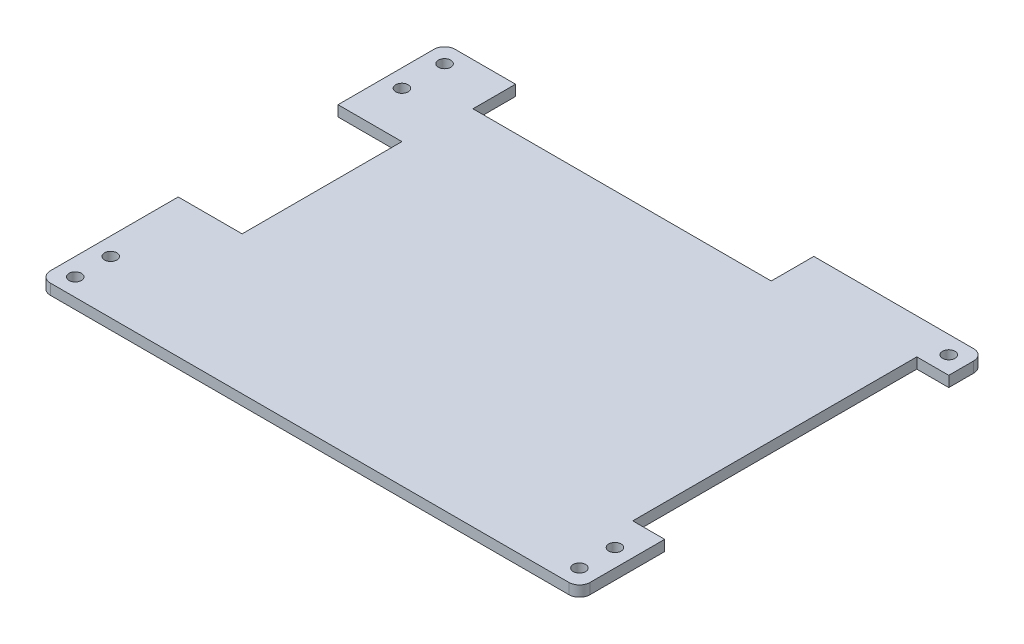
from build123d import *

# Parameters (mm, degrees)
SKETCH_1_R      = 1.75
EXTRUDE_1_DEPTH = 3


with BuildPart() as part:
    # 草图1 → 凸台-拉伸1 (new body)
    with BuildSketch(Plane(origin=(0, 0, 0), x_dir=(1, 0, 0), z_dir=(0, 1, 0))):
        with BuildLine():
            Line((-56, 57), (-56, 45))
            Line((-56, 45), (28, 45))
            Line((28, 45), (28, 57))
            Line((28, 57), (73, 57))
            ThreePointArc((73, 57), (75.121320344, 56.121320344), (76, 54))
            Line((76, 54), (76, 47))
            Line((76, 47), (67, 47))
            Line((67, 47), (67, -33))
            Line((67, -33), (76, -33))
            Line((76, -33), (76, -54))
            ThreePointArc((76, -54), (75.121320344, -56.121320344), (73, -57))
            Line((73, -57), (-73, -57))
            ThreePointArc((-73, -57), (-75.121320344, -56.121320344), (-76, -54))
            Line((-76, -54), (-76, -18))
            Line((-76, -18), (-58, -18))
            Line((-58, -18), (-58, 27))
            Line((-58, 27), (-76, 27))
            Line((-76, 27), (-76, 54))
            ThreePointArc((-76, 54), (-75.121320344, 56.121320344), (-73, 57))
            Line((-73, 57), (-56, 57))
        make_face()
        with Locations((-71, 52)):
            Circle(SKETCH_1_R, mode=Mode.SUBTRACT)
        with Locations((71, 52)):
            Circle(SKETCH_1_R, mode=Mode.SUBTRACT)
        with Locations((71, -52)):
            Circle(SKETCH_1_R, mode=Mode.SUBTRACT)
        with Locations((-71, -52)):
            Circle(SKETCH_1_R, mode=Mode.SUBTRACT)
        with Locations((-71, 40)):
            Circle(SKETCH_1_R, mode=Mode.SUBTRACT)
        with Locations((71, -42)):
            Circle(SKETCH_1_R, mode=Mode.SUBTRACT)
        with Locations((-71, -42)):
            Circle(SKETCH_1_R, mode=Mode.SUBTRACT)
    extrude(amount=EXTRUDE_1_DEPTH)


solid = part.part
